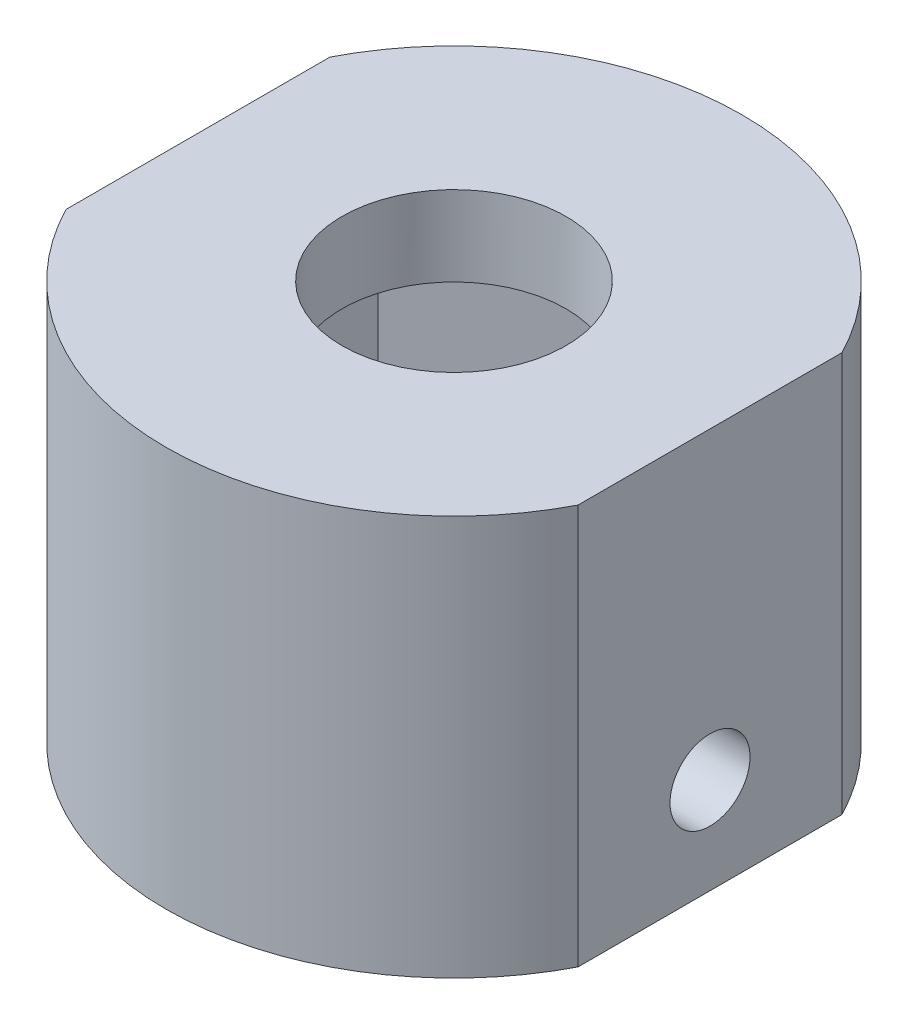
from build123d import *

# Parameters (mm, degrees)
ESBO_O9_R                   = 9
RESSALTO_EXTRUS_O1_DEPTH    = 12.5
ESBO_O12_R                  = 3.5
CORTE_EXTRUS_O9_DEPTH       = 18.839562775
CORTE_EXTRUS_O10_DEPTH      = 10
CORTE_EXTRUS_O11_DEPTH      = 18.839562775
CORTE_EXTRUS_O11_DEPTH_BACK = 18.839562775
ESBO_O14_R                  = 1.25
CORTE_EXTRUS_O12_DEPTH      = 18.83956296


with BuildPart() as part:
    # Esboço9 → Ressalto-extrusão1 (new body)
    with BuildSketch(Plane(origin=(0, 0, 0), x_dir=(1, 0, 0), z_dir=(0, 1, 0))):
        with Locations(Location((0, 0, 0), (0, 0, 270))):
            Circle(ESBO_O9_R)
    extrude(amount=RESSALTO_EXTRUS_O1_DEPTH)

    # Esboço12 → Corte-extrusão9 (cut, through all)
    with BuildSketch(Plane(origin=(0, 12.5, 0), x_dir=(1, 0, 0), z_dir=(0, 1, 0))):
        with Locations(Location((0, 0, 0), (0, 0, 270))):
            Circle(ESBO_O12_R)
    extrude(amount=-CORTE_EXTRUS_O9_DEPTH, mode=Mode.SUBTRACT)

    # Esboço13 → Corte-extrusão10 (cut)
    with BuildSketch(Plane.XZ):
        Polygon((0, 6.495190528), (-5.625, 3.247595264), (-5.625, -3.247595264), (0, -6.495190528), (5.625, -3.247595264), (5.625, 3.247595264), align=None)
    extrude(amount=-CORTE_EXTRUS_O10_DEPTH, mode=Mode.SUBTRACT)

    # Esboço14 → Corte-extrusão11 (cut, two sides: drawn at the far end of the back side and taken through both)
    with BuildSketch(Plane(origin=(0, 0, 0), x_dir=(0, 0, -1), z_dir=(1, 0, 0)).offset(-CORTE_EXTRUS_O11_DEPTH_BACK)):
        with Locations(Location((0, 3, 0), (0, 0, 270))):
            Circle(ESBO_O14_R)
    extrude(amount=CORTE_EXTRUS_O11_DEPTH + CORTE_EXTRUS_O11_DEPTH_BACK, mode=Mode.SUBTRACT)

    # Esboço15 → Corte-extrusão12 (cut, through all)
    with BuildSketch(Plane.XZ):
        with BuildLine():
            Line((-8, 4.123105626), (-8, -4.123105626))
            ThreePointArc((-8, -4.123105626), (-9, 0), (-8, 4.123105626))
        make_face()
        with BuildLine():
            Line((8, 4.123105626), (8, -4.123105626))
            ThreePointArc((8, -4.123105626), (9, 0), (8, 4.123105626))
        make_face()
    extrude(amount=-CORTE_EXTRUS_O12_DEPTH, mode=Mode.SUBTRACT)


solid = part.part
